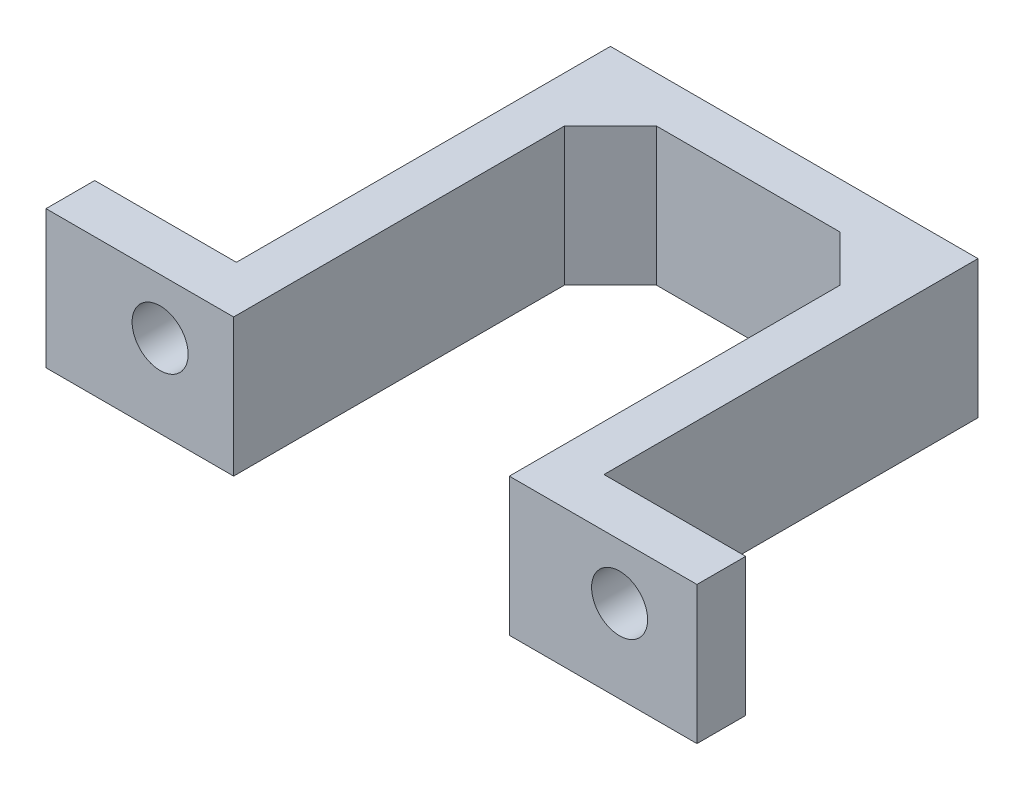
from build123d import *

# Parameters (mm, degrees)
BOSS_EXTRUDE1_DEPTH = 15
SKETCH3_R           = 3.05
CUT_EXTRUDE1_DEPTH  = 15


with BuildPart() as part:
    # Sketch2 → Boss-Extrude1 (new body)
    with BuildSketch(Plane(origin=(0, 0, 0), x_dir=(1, 0, 0), z_dir=(0, 1, 0))):
        Polygon((-13.5, 0), (6.5, 0), (11.5, -5), (11.5, -41), (31.917309801, -41), (31.917309801, -35.69895288), (16.5, -35.69895288), (16.5, 5), (-23.5, 5), (-23.5, -35.69895288), (-38.917309801, -35.69895288), (-38.917309801, -41), (-18.5, -41), (-18.5, -5), align=None)
    extrude(amount=BOSS_EXTRUDE1_DEPTH)

    # Sketch3 → Cut-Extrude1 (cut)
    with BuildSketch(Plane(origin=(0, 0, 35.69895288), x_dir=(-1, 0, 0), z_dir=(0, 0, -1))):
        with Locations((26.5, 9)):
            Circle(SKETCH3_R)
        with Locations((-23.5, 9)):
            Circle(SKETCH3_R)
    extrude(amount=-CUT_EXTRUDE1_DEPTH, mode=Mode.SUBTRACT)


solid = part.part
